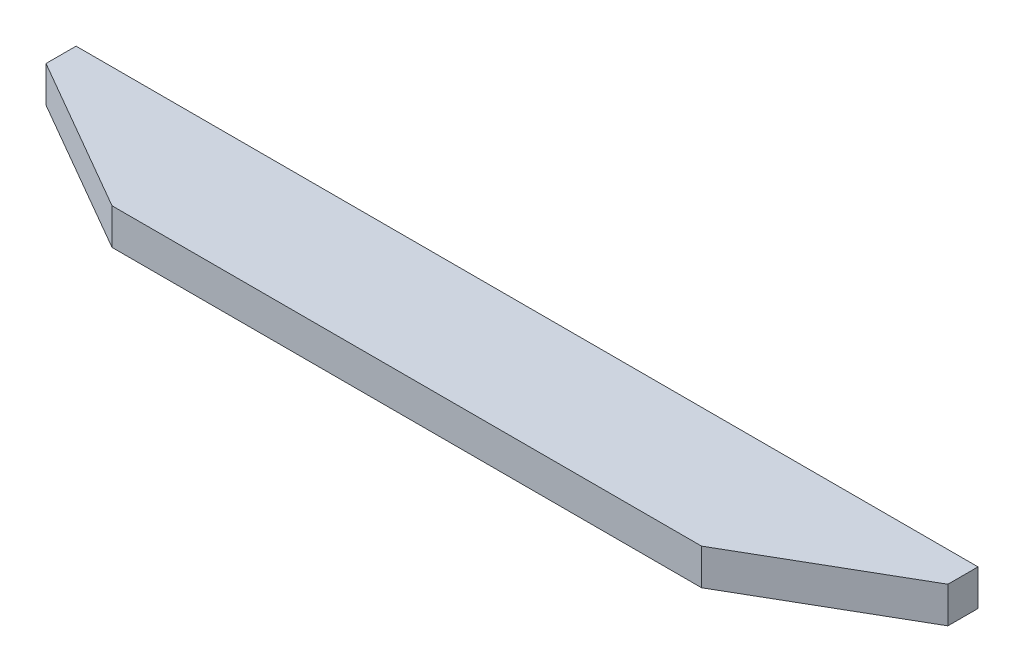
from build123d import *
from OCP.BRepFilletAPI import BRepFilletAPI_MakeChamfer

# Parameters (mm, degrees)
SKETCH_1_W      = 150
SKETCH_1_H      = 6
EXTRUDE_1_DEPTH = 20
CHAMFER_1_SIZE  = 15
CHAMFER_1_SIZE2 = 25.980762114


with BuildPart() as part:
    # Эскиз1 → Бобышка-Вытянуть1 (new body)
    with BuildSketch(Plane.XY):
        with Locations((0, 3)):
            Rectangle(SKETCH_1_W, SKETCH_1_H)
    extrude(amount=EXTRUDE_1_DEPTH)

    # Фаска1: one chamfer whose edges measure the first distance from different faces: ONE call of the kernel's chamfer builder (chamfer() names one face for all edges)
    chamfer_1_edges_1 = [part.edges().sort_by_distance(p)[0] for p in [
        (75, 3, 20),
    ]]
    chamfer_1_side_1 = [part.faces().sort_by_distance(p)[0] for p in [
        (75, 3, 10),
    ]]
    chamfer_1_edges_2 = [part.edges().sort_by_distance(p)[0] for p in [
        (-75, 3, 20),
    ]]
    chamfer_1_side_2 = [part.faces().sort_by_distance(p)[0] for p in [
        (-75, 3, 10),
    ]]
    chamfer_1 = BRepFilletAPI_MakeChamfer(part.part.solid().wrapped)
    for e in chamfer_1_edges_1:
        chamfer_1.Add(CHAMFER_1_SIZE, CHAMFER_1_SIZE2, e.wrapped, chamfer_1_side_1[0].wrapped)  # the first distance lies on this face
    for e in chamfer_1_edges_2:
        chamfer_1.Add(CHAMFER_1_SIZE, CHAMFER_1_SIZE2, e.wrapped, chamfer_1_side_2[0].wrapped)  # the first distance lies on this face
    add(Compound.cast(chamfer_1.Shape()), mode=Mode.REPLACE)


solid = part.part
